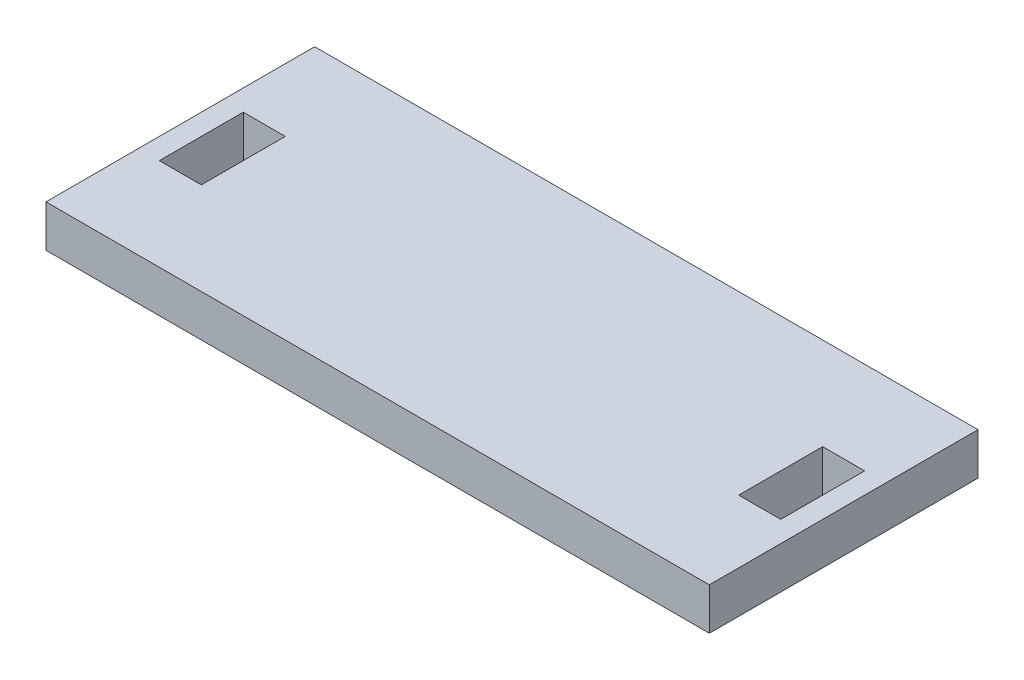
from build123d import *

# Parameters (mm, degrees)
SKETCH1_W           = 50.165
SKETCH1_H           = 20.32
SKETCH1_W_2         = 3.175
SKETCH1_H_2         = 6.35
BOSS_EXTRUDE1_DEPTH = 3.175


with BuildPart() as part:
    # Sketch1 → Boss-Extrude1 (new body)
    with BuildSketch(Plane(origin=(0, 0, 0), x_dir=(1, 0, 0), z_dir=(0, 1, 0))):
        Rectangle(SKETCH1_W, SKETCH1_H)
        with Locations((-21.9075, 0)):
            Rectangle(SKETCH1_W_2, SKETCH1_H_2, mode=Mode.SUBTRACT)
        with Locations((21.9075, 0)):
            Rectangle(SKETCH1_W_2, SKETCH1_H_2, mode=Mode.SUBTRACT)
    extrude(amount=BOSS_EXTRUDE1_DEPTH)


solid = part.part
